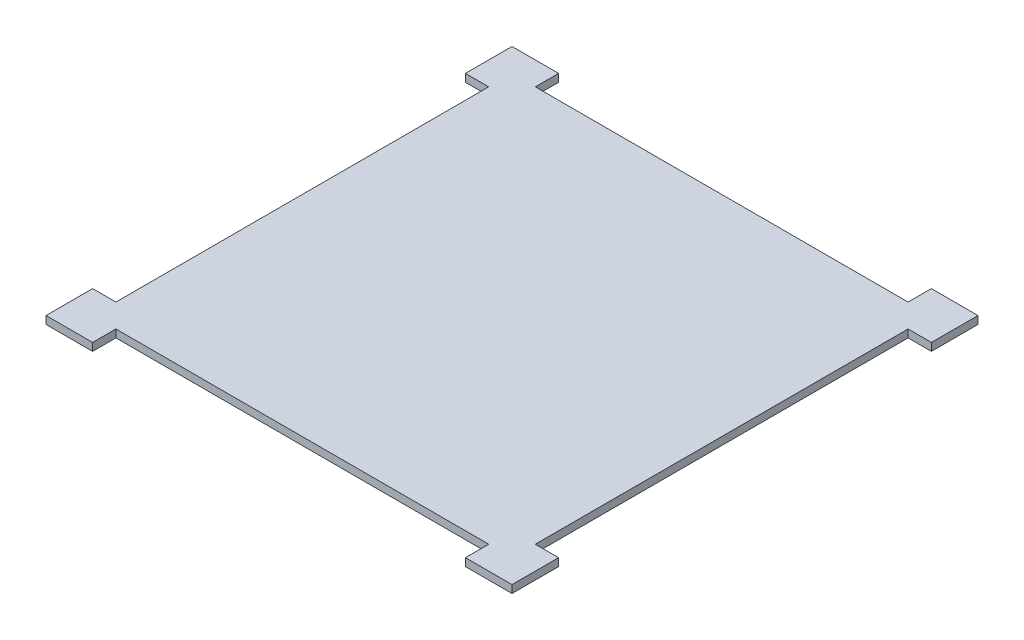
from build123d import *

# Parameters (mm, degrees)
EXTRUDE_1_DEPTH = 5
SKETCH_3_R      = 2.5
EXTRUDE_2_DEPTH = 5


with BuildPart() as part:
    # 草图2 → 凸台-拉伸1 (new body)
    with BuildSketch(Plane(origin=(0, 0, 0), x_dir=(1, 0, 0), z_dir=(0, 1, 0))):
        Polygon((-120, -150), (-120, -135), (120, -135), (120, -150), (150, -150), (150, -120), (135, -120), (135, 120), (150, 120), (150, 150), (120, 150), (120, 135), (-120, 135), (-120, 150), (-150, 150), (-150, 120), (-135, 120), (-135, -120), (-150, -120), (-150, -150), align=None)
    extrude(amount=EXTRUDE_1_DEPTH)

    # 草图3 → 凸台-拉伸2 (add)
    with BuildSketch(Plane(origin=(0, 0, 0), x_dir=(1, 0, 0), z_dir=(0, 1, 0))):
        with Locations(Location((-88.388347648, 88.388347648, 0), (0, 0, 270))):
            Circle(SKETCH_3_R)
        with Locations(Location((88.388347648, 88.388347648, 0), (0, 0, 270))):
            Circle(SKETCH_3_R)
        with Locations(Location((-88.388347648, -88.388347648, 0), (0, 0, 270))):
            Circle(SKETCH_3_R)
        with Locations(Location((88.388347648, -88.388347648, 0), (0, 0, 270))):
            Circle(SKETCH_3_R)
    extrude(amount=-EXTRUDE_2_DEPTH)


solid = part.part
